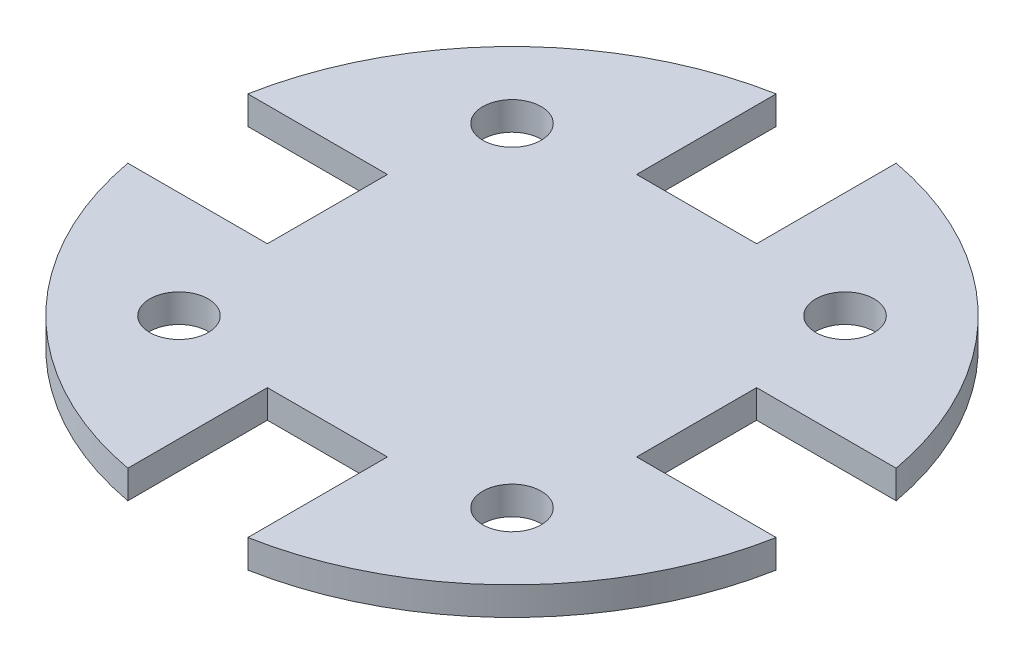
from build123d import *

# Parameters (mm, degrees)
SKETCH1_R           = 35
BOSS_EXTRUDE1_DEPTH = 5
SKETCH2_R           = 3.1
CUT_EXTRUDE1_DEPTH  = 50.749371855
SKETCH3_W           = 12.74
SKETCH3_H           = 10.8
CUT_EXTRUDE2_DEPTH  = 5
CIRPATTERN1_COUNT   = 4
SKETCH4_W           = 12.74
SKETCH4_H           = 5
CUT_EXTRUDE3_DEPTH  = 75.344872049
CIRPATTERN2_COUNT   = 4
CUT_EXTRUDE4_DEPTH  = 2


with BuildPart() as part:
    # Sketch1 → Boss-Extrude1 (new body)
    with BuildSketch(Plane(origin=(0, 0, 0), x_dir=(1, 0, 0), z_dir=(0, 1, 0))):
        with Locations(Location((0, 0, 0), (0, 0, 270))):
            Circle(SKETCH1_R)
    extrude(amount=BOSS_EXTRUDE1_DEPTH)

    # Sketch2 → Cut-Extrude1 (cut, through all)
    with BuildSketch(Plane(origin=(0, 5, 0), x_dir=(1, 0, 0), z_dir=(0, 1, 0))):
        with Locations(Location((-17.67766953, 17.67766953, 0), (0, 0, 270))):
            Circle(SKETCH2_R)
        with Locations(Location((17.67766953, 17.67766953, 0), (0, 0, 270))):
            Circle(SKETCH2_R)
        with Locations(Location((17.67766953, -17.67766953, 0), (0, 0, 270))):
            Circle(SKETCH2_R)
        with Locations(Location((-17.67766953, -17.67766953, 0), (0, 0, 270))):
            Circle(SKETCH2_R)
    extrude(amount=-CUT_EXTRUDE1_DEPTH, mode=Mode.SUBTRACT)

    # Sketch3 → Cut-Extrude2 (cut)
    with BuildSketch(Plane(origin=(0, 5, 0), x_dir=(1, 0, 0), z_dir=(0, 1, 0))):
        with Locations((0, 25)):
            Rectangle(SKETCH3_W, SKETCH3_H)
    cut_extrude2 = extrude(amount=-CUT_EXTRUDE2_DEPTH, mode=Mode.SUBTRACT)

    # CirPattern1: Cut-Extrude2 ×4 about axis
    cirpattern1_axis = Axis((0, 0, 0), (0, 1, 0))
    for i in range(1, CIRPATTERN1_COUNT):
        add(cut_extrude2.rotate(cirpattern1_axis, i * 360 / CIRPATTERN1_COUNT), mode=Mode.SUBTRACT)

    # Sketch4 → Cut-Extrude3 (cut, through all)
    with BuildSketch(Plane.XY.offset(-30.4)):
        with Locations((0, 2.5)):
            Rectangle(SKETCH4_W, SKETCH4_H)
    cut_extrude3 = extrude(amount=-CUT_EXTRUDE3_DEPTH, mode=Mode.SUBTRACT)

    # CirPattern2: Cut-Extrude3 ×4 about axis
    cirpattern2_axis = Axis((0, 5, 0), (0, 1, 0))
    for i in range(1, CIRPATTERN2_COUNT):
        add(cut_extrude3.rotate(cirpattern2_axis, i * 360 / CIRPATTERN2_COUNT), mode=Mode.SUBTRACT)

    # Sketch5 → Cut-Extrude4 (cut)
    with BuildSketch(Plane.XZ):
        with BuildLine():
            Line((-19.6, -6.37), (-34.415448566, -6.37))
            ThreePointArc((-34.415448566, -6.37), (-24.748737342, -24.748737342), (-6.37, -34.415448566))
            Line((-6.37, -34.415448566), (-6.37, -19.6))
            Line((-6.37, -19.6), (6.37, -19.6))
            Line((6.37, -19.6), (6.37, -34.415448566))
            ThreePointArc((6.37, -34.415448566), (24.748737342, -24.748737342), (34.415448566, -6.37))
            Line((34.415448566, -6.37), (19.6, -6.37))
            Line((19.6, -6.37), (19.6, 6.37))
            Line((19.6, 6.37), (34.415448566, 6.37))
            ThreePointArc((34.415448566, 6.37), (24.748737342, 24.748737342), (6.37, 34.415448566))
            Line((6.37, 34.415448566), (6.37, 19.6))
            Line((6.37, 19.6), (-6.37, 19.6))
            Line((-6.37, 19.6), (-6.37, 34.415448566))
            ThreePointArc((-6.37, 34.415448566), (-24.748737342, 24.748737342), (-34.415448566, 6.37))
            Line((-34.415448566, 6.37), (-19.6, 6.37))
            Line((-19.6, 6.37), (-19.6, -6.37))
        make_face()
    extrude(amount=-CUT_EXTRUDE4_DEPTH, mode=Mode.SUBTRACT)


solid = part.part
